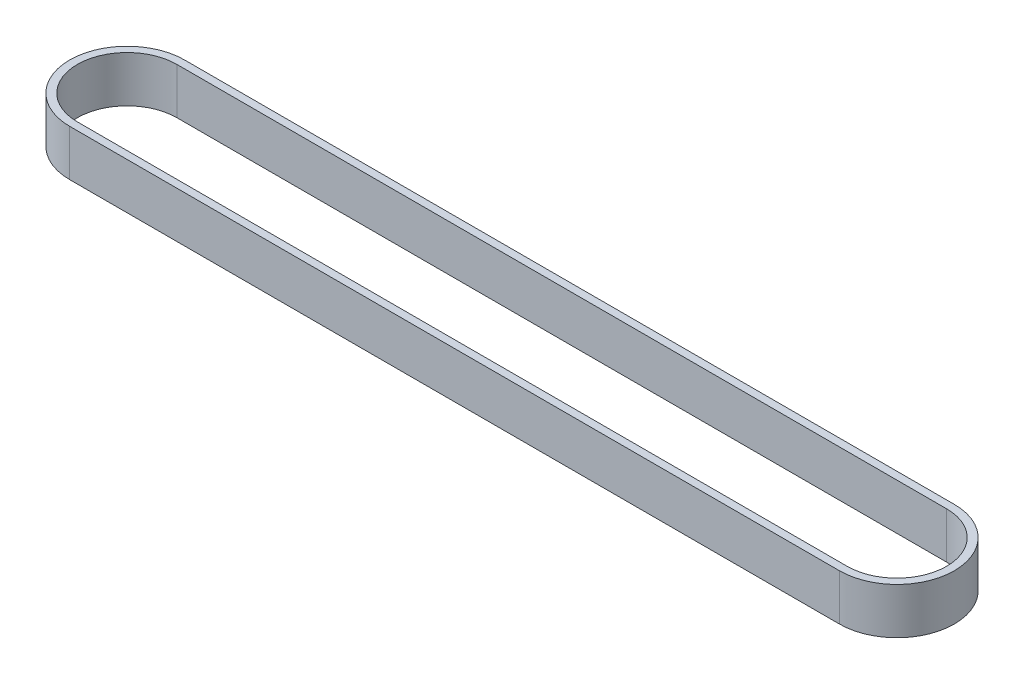
from build123d import *

# Parameters (mm, degrees)
EXTRUDE_1_DEPTH = 6


with BuildPart() as part:
    # 草图1 → 凸台-拉伸1 (new body)
    with BuildSketch(Plane(origin=(0, 0, 0), x_dir=(1, 0, 0), z_dir=(0, 1, 0))):
        with BuildLine():
            Line((-50, 7.465), (50, 7.465))
            ThreePointArc((50, 7.465), (57.465, 0), (50, -7.465))
            Line((50, -7.465), (-50, -7.465))
            ThreePointArc((-50, -7.465), (-57.465, 0), (-50, 7.465))
        make_face()
        with BuildLine():
            Line((-50, 6.465), (50, 6.465))
            ThreePointArc((50, 6.465), (56.465, 0), (50, -6.465))
            Line((50, -6.465), (-50, -6.465))
            ThreePointArc((-50, -6.465), (-56.465, 0), (-50, 6.465))
        make_face(mode=Mode.SUBTRACT)
    extrude(amount=EXTRUDE_1_DEPTH)


solid = part.part
